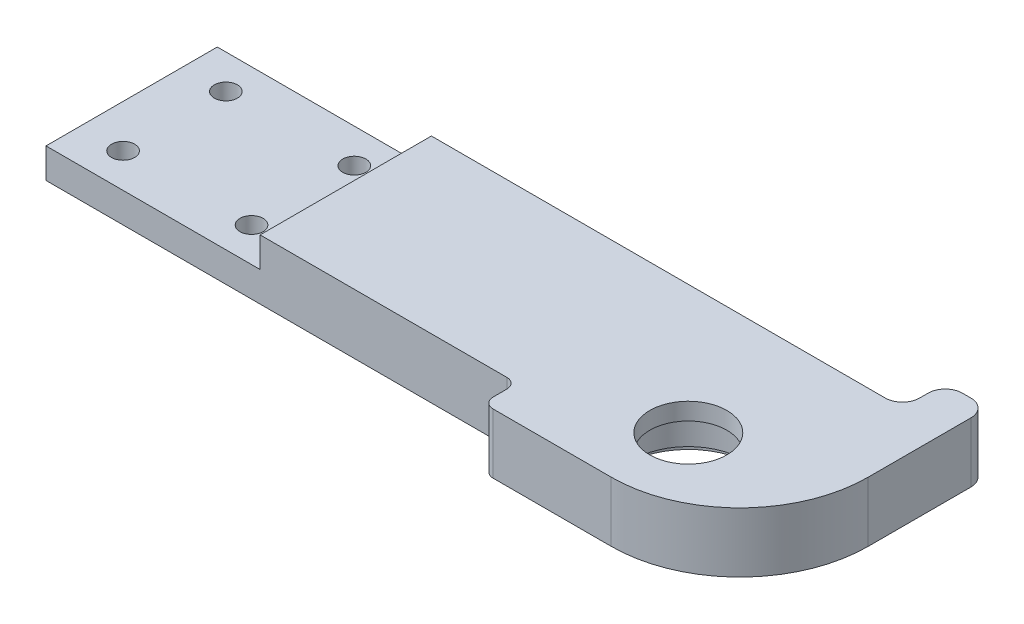
from build123d import *

# Parameters (mm, degrees)
SKETCH1_R           = 4.5
BOSS_EXTRUDE1_DEPTH = 7
SKETCH2_W           = 25
SKETCH2_H           = 20
CUT_EXTRUDE1_DEPTH  = 3.5
SKETCH3_R           = 1.35
CUT_EXTRUDE2_DEPTH  = 14
FILLET2_R           = 1.2
SKETCH4_R           = 7.5
CUT_EXTRUDE3_DEPTH  = 1
SKETCH5_R           = 6.5
CUT_EXTRUDE4_DEPTH  = 4
FILLET3_R           = 15
SKETCH6_W           = 5
SKETCH6_H           = 5
BOSS_EXTRUDE2_DEPTH = 7
FILLET4_R           = 2
SKETCH7_W           = 110.688595786
SKETCH7_H           = 55.300338959
CUT_EXTRUDE5_DEPTH  = 7


with BuildPart() as part:
    # Sketch1 → Boss-Extrude1 (new body)
    with BuildSketch(Plane(origin=(0, 0, 0), x_dir=(1, 0, 0), z_dir=(0, 1, 0))):
        Polygon((0, 0), (55, 0), (55, -4), (85, -4), (85, 0), (85, 20), (0, 20), align=None)
        with Locations(Location((70, 5, 0), (0, 0, 270))):
            Circle(SKETCH1_R, mode=Mode.SUBTRACT)
    extrude(amount=BOSS_EXTRUDE1_DEPTH)

    # Sketch2 → Cut-Extrude1 (cut)
    with BuildSketch(Plane.XZ):
        with Locations((12.5, -10)):
            Rectangle(SKETCH2_W, SKETCH2_H)
    extrude(amount=-CUT_EXTRUDE1_DEPTH, mode=Mode.SUBTRACT)

    # Sketch3 → Cut-Extrude2 (cut)
    with BuildSketch(Plane.XZ.offset(-3.5)):
        with Locations(Location((5, -4, 0), (0, 0, 270))):
            Circle(SKETCH3_R)
        with Locations(Location((20, -4, 0), (0, 0, 270))):
            Circle(SKETCH3_R)
        with Locations(Location((20, -16, 0), (0, 0, 270))):
            Circle(SKETCH3_R)
        with Locations(Location((5, -16, 0), (0, 0, 270))):
            Circle(SKETCH3_R)
    extrude(amount=-CUT_EXTRUDE2_DEPTH, mode=Mode.SUBTRACT)

    # Fillet2
    fillet2_edges = [part.edges().sort_by_distance(p)[0] for p in [
        (55, 3.5, 4),
        (55, 3.5, 0),
    ]]
    fillet(fillet2_edges, radius=FILLET2_R)

    # Sketch4 → Cut-Extrude3 (cut)
    with BuildSketch(Plane(origin=(0, 7, 0), x_dir=(1, 0, 0), z_dir=(0, 1, 0))):
        with Locations(Location((70, 5, 0), (0, 0, 270))):
            Circle(SKETCH4_R)
    extrude(amount=-CUT_EXTRUDE3_DEPTH, mode=Mode.SUBTRACT)

    # Sketch5 → Cut-Extrude4 (cut)
    with BuildSketch(Plane(origin=(0, 6, 0), x_dir=(1, 0, 0), z_dir=(0, 1, 0))):
        with Locations(Location((70, 5, 0), (0, 0, 270))):
            Circle(SKETCH5_R)
    extrude(amount=-CUT_EXTRUDE4_DEPTH, mode=Mode.SUBTRACT)

    # Fillet3
    fillet3_edges = [part.edges().sort_by_distance(p)[0] for p in [
        (85, 3.5, 4),
    ]]
    fillet(fillet3_edges, radius=FILLET3_R)

    # Sketch6 → Boss-Extrude2 (add)
    with BuildSketch(Plane(origin=(0, 7, 0), x_dir=(1, 0, 0), z_dir=(0, 1, 0))):
        with Locations((82.5, 22.5)):
            Rectangle(SKETCH6_W, SKETCH6_H)
    extrude(amount=-BOSS_EXTRUDE2_DEPTH)

    # Fillet4
    fillet4_edges = [part.edges().sort_by_distance(p)[0] for p in [
        (80, 3.5, -25),
        (80, 3.5, -20),
        (85, 3.5, -25),
    ]]
    fillet(fillet4_edges, radius=FILLET4_R)

    # Mirror1: part across plane


with BuildPart() as part_1:
    add(part.part)
    add(part.part.mirror(Plane(origin=(0, 0, 0), x_dir=(0, 0, 1), z_dir=(0, -1, 0))))

    # Sketch7 → Cut-Extrude5 (cut)
    with BuildSketch(Plane(origin=(0, 7, 0), x_dir=(1, 0, 0), z_dir=(0, 1, 0))):
        with Locations((37.884311931, 10.917741369)):
            Rectangle(SKETCH7_W, SKETCH7_H)
    extrude(amount=-CUT_EXTRUDE5_DEPTH, mode=Mode.SUBTRACT)


solid = part_1.part
